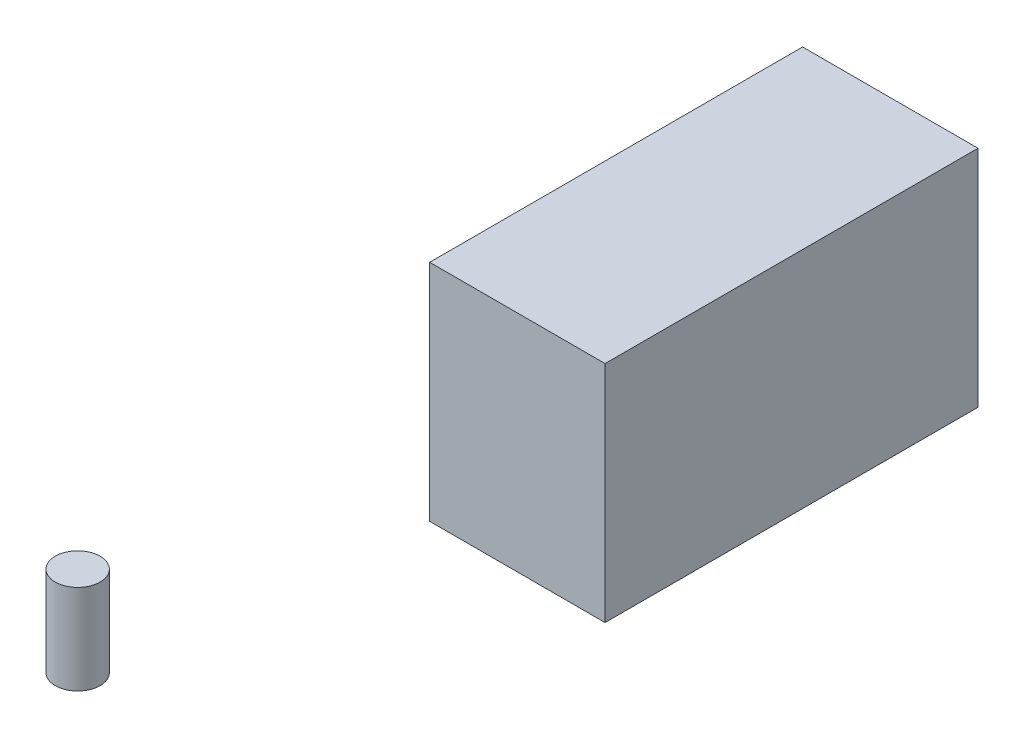
from build123d import *

# Parameters (mm, degrees)
CROQUIS1_R              = 2.5
SALIENTE_EXTRUIR1_DEPTH = 10
CROQUIS2_W              = 19.547187756
CROQUIS2_H              = 41.558983128
SALIENTE_EXTRUIR2_DEPTH = 25


with BuildPart() as part:
    # Croquis1 → Saliente-Extruir1 (new body)
    with BuildSketch(Plane(origin=(0, 0, 0), x_dir=(1, 0, 0), z_dir=(0, 1, 0))):
        with Locations(Location((0, 0, 0), (0, 0, 270))):
            Circle(CROQUIS1_R)
    extrude(amount=SALIENTE_EXTRUIR1_DEPTH)


with BuildPart() as body_2:
    # Croquis2 → Saliente-Extruir2 (new body)
    with BuildSketch(Plane(origin=(0, 0, 0), x_dir=(1, 0, 0), z_dir=(0, 1, 0))):
        with Locations((14.773593878, 55.00269981)):
            Rectangle(CROQUIS2_W, CROQUIS2_H)
    extrude(amount=SALIENTE_EXTRUIR2_DEPTH)


solid = Compound([part.part, body_2.part])
